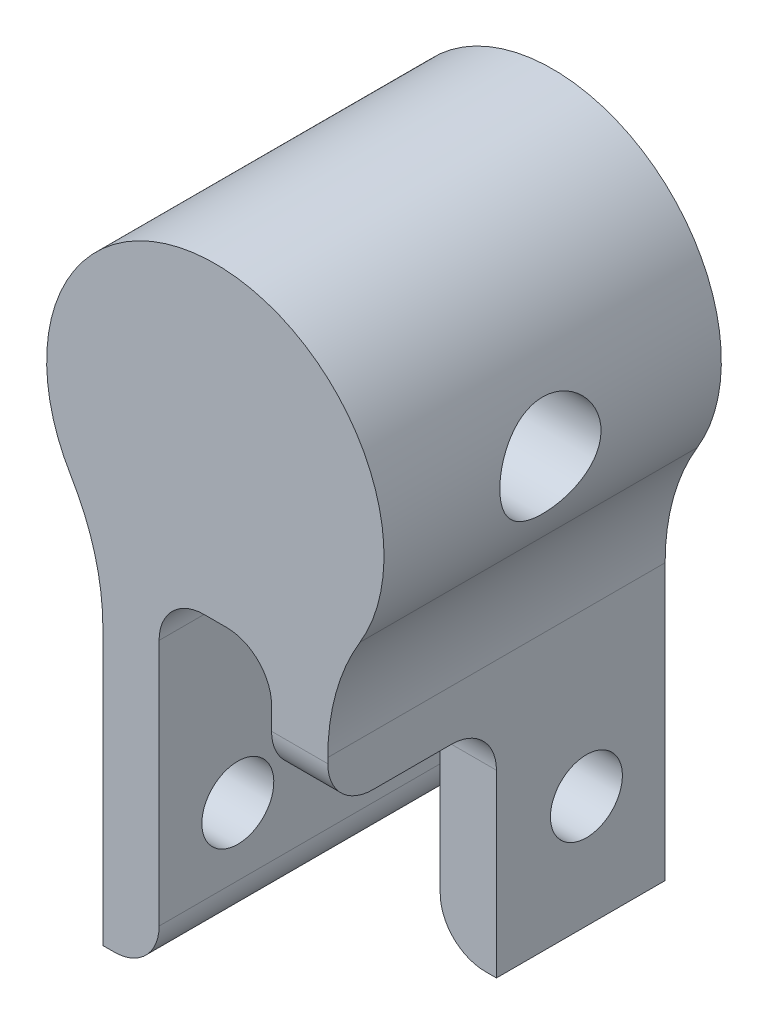
from build123d import *

# Parameters (mm, degrees)
BOSS_EXTRUDE1_DEPTH = 15
FILLET1_R           = 10
CUT_EXTRUDE4_REACH  = 30.862
SKETCH7_W           = 7.5
SKETCH7_H           = 10
CUT_EXTRUDE7_REACH  = 30.862
SKETCH10_R          = 1.6
SKETCH9_R           = 1.6
CUT_EXTRUDE8_DEPTH  = 29.861852882
FILLET3_R           = 2
SKETCH3_R           = 2.05
CUT_EXTRUDE9_DEPTH  = 10
SKETCH11_R          = 2.25
CUT_EXTRUDE10_DEPTH = 15


with BuildPart() as part:
    # Sketch2 → Boss-Extrude1 (new body)
    with BuildSketch(Plane.XY):
        with BuildLine():
            Line((-2.5, -6.254565433), (-2.5, -21.254565433))
            Line((-2.5, -21.254565433), (-5, -21.254565433))
            Line((-5, -21.254565433), (-5, -6.254565433))
            Line((-5, -6.254565433), (-5, -5.590169944))
            ThreePointArc((-5, -5.590169944), (0, 7.5), (5, -5.590169944))
            Line((5, -5.590169944), (5, -6.254565433))
            Line((5, -6.254565433), (5, -21.254565433))
            Line((5, -21.254565433), (2.5, -21.254565433))
            Line((2.5, -21.254565433), (2.5, -6.254565433))
            Line((2.5, -6.254565433), (-2.5, -6.254565433))
        make_face()
    extrude(amount=BOSS_EXTRUDE1_DEPTH)

    # Fillet1
    fillet1_edges = [part.edges().sort_by_distance(p)[0] for p in [
        (-5, -5.590169944, 7.5),
        (5, -5.590169944, 7.5),
    ]]
    fillet(fillet1_edges, radius=FILLET1_R)

    # Sketch7 → Cut-Extrude4 (cut, up to next)
    with BuildSketch(Plane(origin=(5, 0, 0), x_dir=(0, 0, -1), z_dir=(1, 0, 0)), mode=Mode.PRIVATE) as cut_extrude4_sk1:
        with Locations((-11.25, -16.254565433)):
            Rectangle(SKETCH7_W, SKETCH7_H)
    cut_extrude4_tool1 = extrude(cut_extrude4_sk1.sketch, amount=-CUT_EXTRUDE4_REACH, mode=Mode.PRIVATE) & part.part
    add(cut_extrude4_tool1.solids().sort_by_distance((5, -16.254565, 11.25))[0], mode=Mode.SUBTRACT)

    # Sketch10 → Cut-Extrude7 (cut, up to next)
    with BuildSketch(Plane.ZY.offset(5), mode=Mode.PRIVATE) as cut_extrude7_sk1:
        with Locations((11.5, -16.254565433)):
            Circle(SKETCH10_R)
    cut_extrude7_tool1 = extrude(cut_extrude7_sk1.sketch, amount=-CUT_EXTRUDE7_REACH, mode=Mode.PRIVATE) & part.part
    add(cut_extrude7_tool1.solids().sort_by_distance((-5, -16.254565, 11.5))[0], mode=Mode.SUBTRACT)

    # Sketch9 → Cut-Extrude8 (cut, through all)
    with BuildSketch(Plane.ZY.offset(5)):
        with Locations((3.5, -16.254565433)):
            Circle(SKETCH9_R)
    extrude(amount=-CUT_EXTRUDE8_DEPTH, mode=Mode.SUBTRACT)

    # Fillet3
    fillet3_edges = [part.edges().sort_by_distance(p)[0] for p in [
        (-2.5, -6.254565433, 7.5),
        (-2.5, -21.254565433, 7.5),
        (2.5, -6.254565433, 7.5),
        (2.5, -21.254565433, 3.75),
        (3.75, -11.254565433, 15),
        (3.75, -11.254565433, 7.5),
    ]]
    fillet(fillet3_edges, radius=FILLET3_R)

    # Sketch3 → Cut-Extrude9 (cut)
    with BuildSketch(Plane(origin=(0, 0, 0), x_dir=(-1, 0, 0), z_dir=(0, 0, -1))):
        Circle(SKETCH3_R)
    extrude(amount=-CUT_EXTRUDE9_DEPTH, mode=Mode.SUBTRACT)

    # Sketch11 → Cut-Extrude10 (cut, symmetric)
    with BuildSketch(Plane.ZY.offset(5)):
        with Locations((7.6, 0)):
            Circle(SKETCH11_R)
    extrude(amount=CUT_EXTRUDE10_DEPTH, both=True, mode=Mode.SUBTRACT)


solid = part.part
